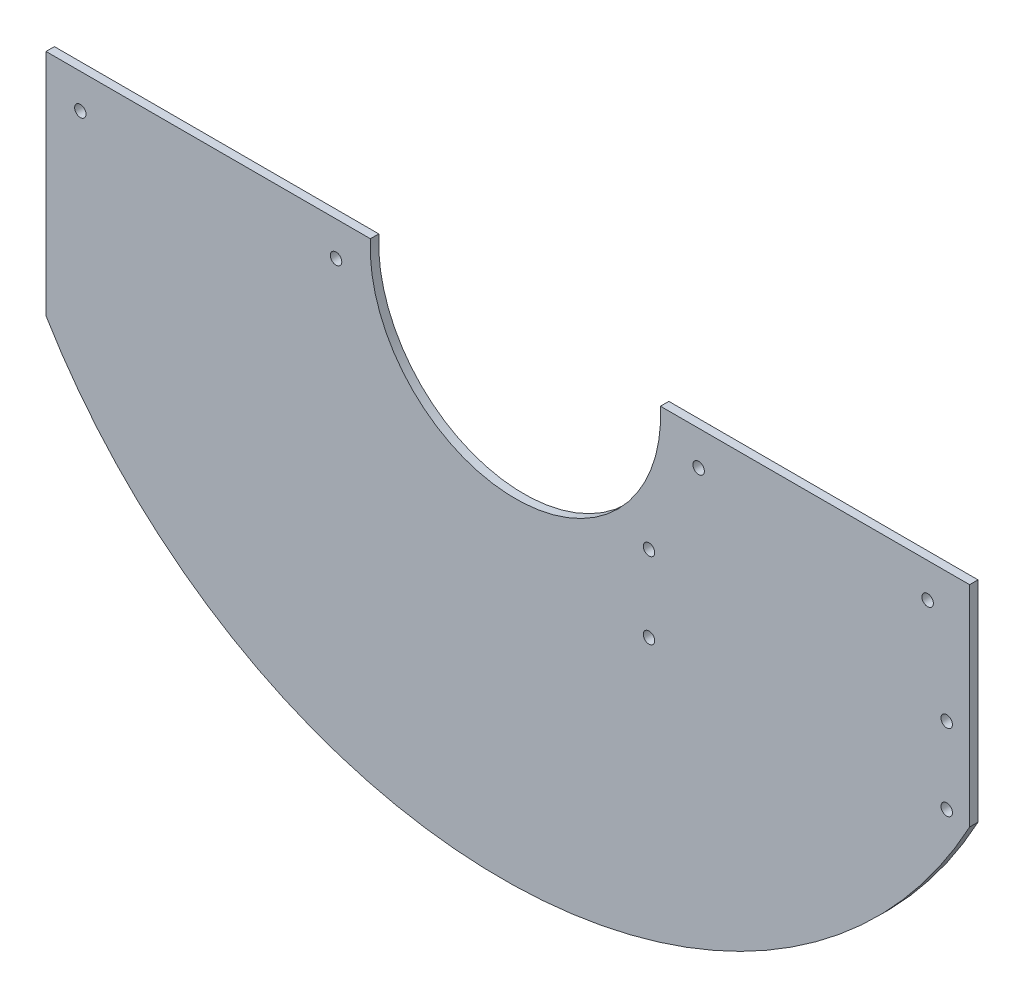
from build123d import *

# Parameters (mm, degrees)
BOSS_EXTRUDE1_DEPTH = 2.2
CUT_EXTRUDE1_REACH  = 178.497
SKETCH4_R           = 1.5
CUT_EXTRUDE2_REACH  = 178.497
SKETCH5_R           = 1.5


with BuildPart() as part:
    # Sketch2 → Boss-Extrude1 (new body)
    with BuildSketch(Plane.XY):
        with BuildLine():
            Line((-121.5, 0), (-36.5, 0))
            ThreePointArc((-36.5, 0), (1.5, -40), (39.5, 0))
            Line((39.5, 0), (120.5, 0))
            Line((120.5, 0), (120.5, -55))
            ThreePointArc((120.5, -55), (0.955998142, -127.970310059), (-121.5, -60))
            Line((-121.5, -60), (-121.5, 0))
        make_face()
    extrude(amount=BOSS_EXTRUDE1_DEPTH)

    # Sketch4 → Cut-Extrude1 (cut, up to next)
    with BuildSketch(Plane.XY.offset(2.2), mode=Mode.PRIVATE) as cut_extrude1_sk1:
        with Locations((109.5, -9)):
            Circle(SKETCH4_R)
    cut_extrude1_tool1 = extrude(cut_extrude1_sk1.sketch, amount=-CUT_EXTRUDE1_REACH, mode=Mode.PRIVATE) & part.part
    # Sketch4 → Cut-Extrude1 (cut, up to next)
    with BuildSketch(Plane.XY.offset(2.2), mode=Mode.PRIVATE) as cut_extrude1_sk2:
        with Locations((49.5, -9)):
            Circle(SKETCH4_R)
    cut_extrude1_tool2 = extrude(cut_extrude1_sk2.sketch, amount=-CUT_EXTRUDE1_REACH, mode=Mode.PRIVATE) & part.part
    # Sketch4 → Cut-Extrude1 (cut, up to next)
    with BuildSketch(Plane.XY.offset(2.2), mode=Mode.PRIVATE) as cut_extrude1_sk3:
        with Locations((-45.5, -9)):
            Circle(SKETCH4_R)
    cut_extrude1_tool3 = extrude(cut_extrude1_sk3.sketch, amount=-CUT_EXTRUDE1_REACH, mode=Mode.PRIVATE) & part.part
    # Sketch4 → Cut-Extrude1 (cut, up to next)
    with BuildSketch(Plane.XY.offset(2.2), mode=Mode.PRIVATE) as cut_extrude1_sk4:
        with Locations((-112.5, -9)):
            Circle(SKETCH4_R)
    cut_extrude1_tool4 = extrude(cut_extrude1_sk4.sketch, amount=-CUT_EXTRUDE1_REACH, mode=Mode.PRIVATE) & part.part
    add(cut_extrude1_tool1.solids().sort_by_distance((109.5, -9, 2.2))[0], mode=Mode.SUBTRACT)
    add(cut_extrude1_tool2.solids().sort_by_distance((49.5, -9, 2.2))[0], mode=Mode.SUBTRACT)
    add(cut_extrude1_tool3.solids().sort_by_distance((-45.5, -9, 2.2))[0], mode=Mode.SUBTRACT)
    add(cut_extrude1_tool4.solids().sort_by_distance((-112.5, -9, 2.2))[0], mode=Mode.SUBTRACT)

    # Sketch5 → Cut-Extrude2 (cut, up to next)
    with BuildSketch(Plane.XY.offset(2.2), mode=Mode.PRIVATE) as cut_extrude2_sk1:
        with Locations((114.5, -34)):
            Circle(SKETCH5_R)
    cut_extrude2_tool1 = extrude(cut_extrude2_sk1.sketch, amount=-CUT_EXTRUDE2_REACH, mode=Mode.PRIVATE) & part.part
    # Sketch5 → Cut-Extrude2 (cut, up to next)
    with BuildSketch(Plane.XY.offset(2.2), mode=Mode.PRIVATE) as cut_extrude2_sk2:
        with Locations((114.5, -54)):
            Circle(SKETCH5_R)
    cut_extrude2_tool2 = extrude(cut_extrude2_sk2.sketch, amount=-CUT_EXTRUDE2_REACH, mode=Mode.PRIVATE) & part.part
    # Sketch5 → Cut-Extrude2 (cut, up to next)
    with BuildSketch(Plane.XY.offset(2.2), mode=Mode.PRIVATE) as cut_extrude2_sk3:
        with Locations((36.5, -34)):
            Circle(SKETCH5_R)
    cut_extrude2_tool3 = extrude(cut_extrude2_sk3.sketch, amount=-CUT_EXTRUDE2_REACH, mode=Mode.PRIVATE) & part.part
    # Sketch5 → Cut-Extrude2 (cut, up to next)
    with BuildSketch(Plane.XY.offset(2.2), mode=Mode.PRIVATE) as cut_extrude2_sk4:
        with Locations((36.5, -54)):
            Circle(SKETCH5_R)
    cut_extrude2_tool4 = extrude(cut_extrude2_sk4.sketch, amount=-CUT_EXTRUDE2_REACH, mode=Mode.PRIVATE) & part.part
    add(cut_extrude2_tool1.solids().sort_by_distance((114.5, -34, 2.2))[0], mode=Mode.SUBTRACT)
    add(cut_extrude2_tool2.solids().sort_by_distance((114.5, -54, 2.2))[0], mode=Mode.SUBTRACT)
    add(cut_extrude2_tool3.solids().sort_by_distance((36.5, -34, 2.2))[0], mode=Mode.SUBTRACT)
    add(cut_extrude2_tool4.solids().sort_by_distance((36.5, -54, 2.2))[0], mode=Mode.SUBTRACT)


solid = part.part
